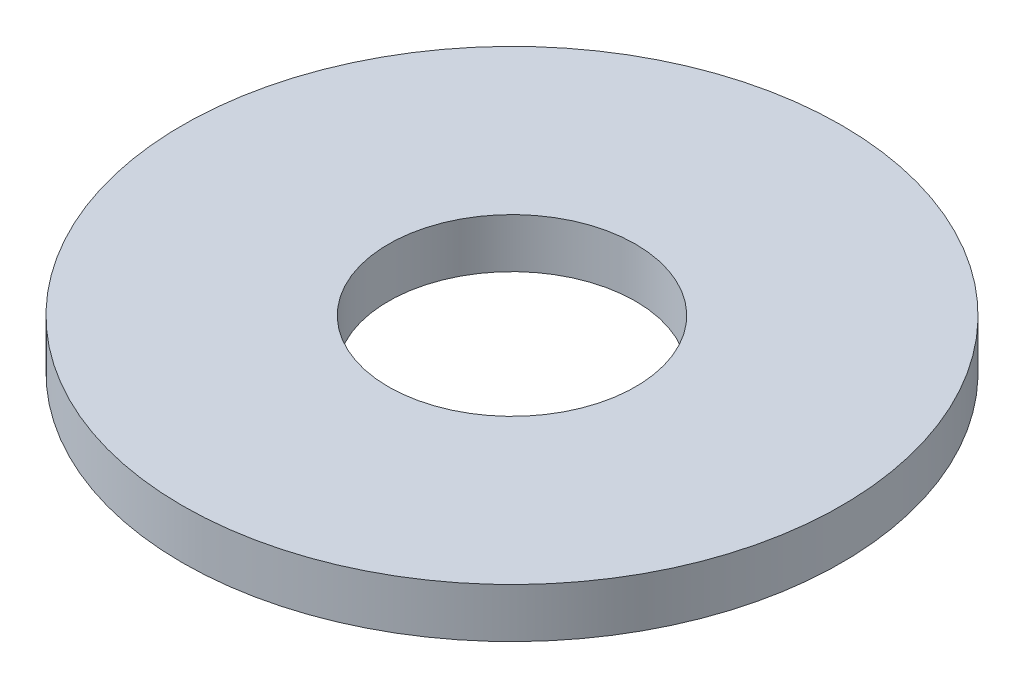
from build123d import *

# Parameters (mm, degrees)
SKETCH1_R           = 20
SKETCH1_R_2         = 7.5
BOSS_EXTRUDE1_DEPTH = 3


with BuildPart() as part:
    # Sketch1 → Boss-Extrude1 (new body)
    with BuildSketch(Plane(origin=(0, 0, 0), x_dir=(1, 0, 0), z_dir=(0, 1, 0))):
        with Locations(Location((0, 0, 0), (0, 0, 270))):
            Circle(SKETCH1_R)
        with Locations(Location((0, 0, 0), (0, 0, 270))):
            Circle(SKETCH1_R_2, mode=Mode.SUBTRACT)
    extrude(amount=BOSS_EXTRUDE1_DEPTH)


solid = part.part
